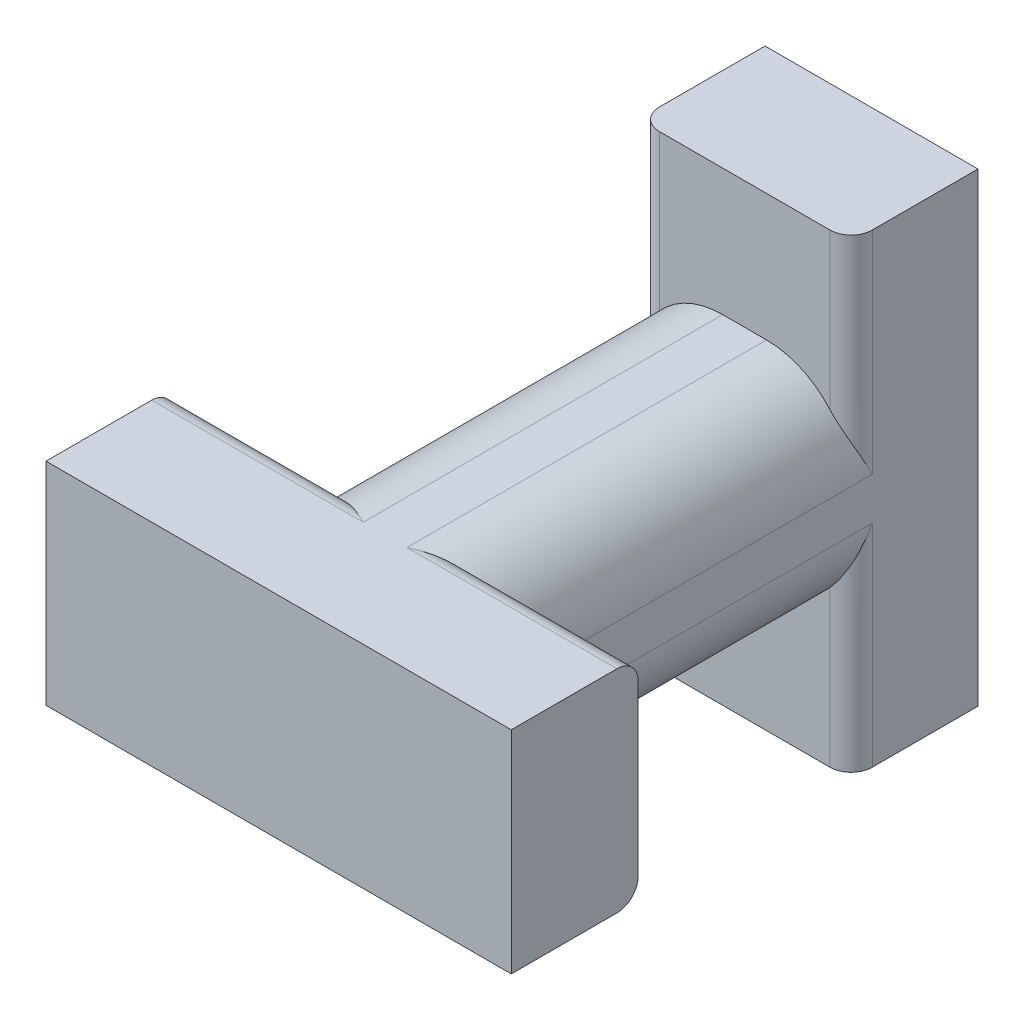
from build123d import *

# Parameters (mm, degrees)
ESQUISSE1_W         = 5.035107038
ESQUISSE1_H         = 5
BASE_DEPTH          = 8
BOSS_1_DEPTH        = 3
BOSS_1_DEPTH_BACK   = 8
ESQUISSE4_W         = 5.035107038
ESQUISSE4_H         = 3
BOSS_2_DEPTH        = 3
BOSS_2_DEPTH_BACK   = 8
ESQUISSE5_W         = 3
ESQUISSE5_H         = 5
CONGE_MILIEU_R      = 2
CONGE_HAUT_ET_BAS_R = 0.5


with BuildPart() as part:
    # Esquisse1 → BASE (new body)
    with BuildSketch(Plane.XY):
        with Locations((34.295782161, 18.98164147)):
            Rectangle(ESQUISSE1_W, ESQUISSE1_H)
    extrude(amount=BASE_DEPTH)

    # Esquisse4 → BOSS 1 (add, two sides: drawn at the far end of the back side and taken through both)
    with BuildSketch(Plane(origin=(0, 21.48164147, 0), x_dir=(1, 0, 0), z_dir=(0, 1, 0)).offset(-BOSS_1_DEPTH_BACK)):
        with Locations((34.295782161, 1.5)):
            Rectangle(ESQUISSE4_W, ESQUISSE4_H)
    extrude(amount=BOSS_1_DEPTH + BOSS_1_DEPTH_BACK)

    # Esquisse5 → BOSS 2 (add, two sides: drawn at the far end of the back side and taken through both)
    with BuildSketch(Plane.ZY.offset(-31.778228642).offset(-BOSS_2_DEPTH_BACK)):
        with Locations((9.5, 18.98164147)):
            Rectangle(ESQUISSE5_W, ESQUISSE5_H)
    extrude(amount=BOSS_2_DEPTH + BOSS_2_DEPTH_BACK)

    # CONGE MILIEU
    conge_milieu_edges = [part.edges().sort_by_distance(p)[0] for p in [
        (36.81333568, 21.48164147, 4),
        (31.778228642, 21.48164147, 4),
        (31.778228642, 16.48164147, 4),
        (36.81333568, 16.48164147, 4),
    ]]
    fillet(conge_milieu_edges, radius=CONGE_MILIEU_R)

    # CONGE HAUT ET BAS
    conge_haut_et_bas_edges = [part.edges().sort_by_distance(p)[0] for p in [
        (36.81333568, 15.98164147, 0),
        (36.81333568, 21.98164147, 0),
        (31.778228642, 15.98164147, 0),
        (31.778228642, 21.98164147, 0),
        (37.295782161, 16.48164147, 8),
        (31.278228642, 16.48164147, 8),
        (37.295782161, 21.48164147, 8),
        (31.278228642, 21.48164147, 8),
    ]]
    fillet(conge_haut_et_bas_edges, radius=CONGE_HAUT_ET_BAS_R)


solid = part.part
